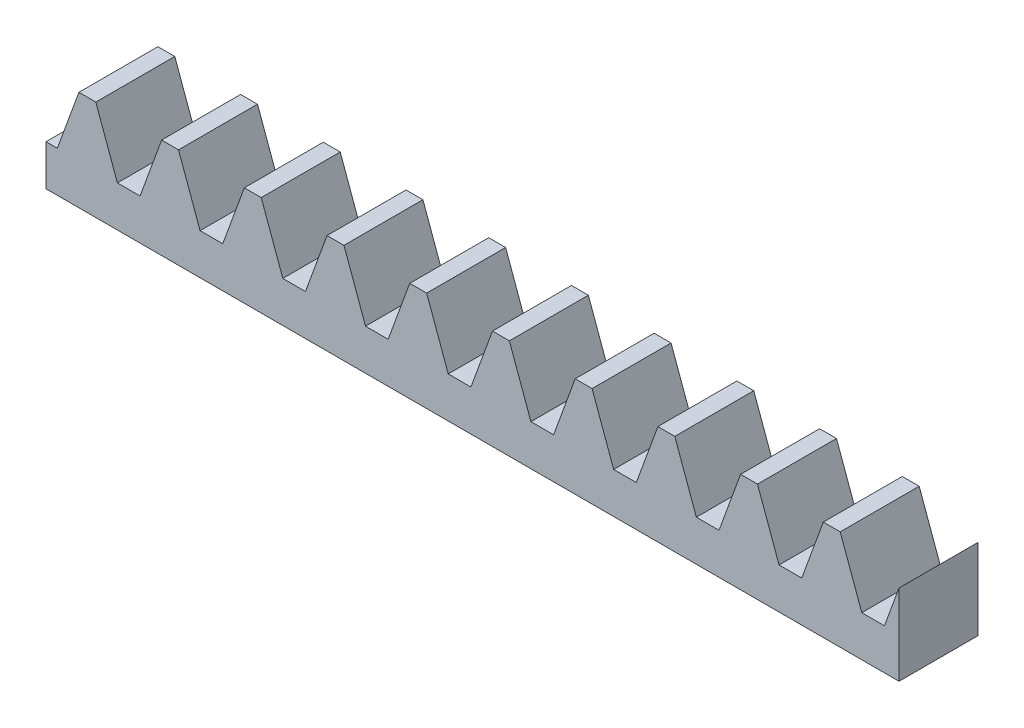
from build123d import *

# Parameters (mm, degrees)
BLANKSKE_W         = 300
BLANKSKE_H         = 45
BLANK_DEPTH        = 30
TOOTHCUTSIM_DEPTH  = 305.836021494
TEETHCUTS_COUNT    = 20
TEETHCUTS_PITCH    = 15.70796325
SKETCH1_W          = 305.531648247
SKETCH1_H          = 78.813182986
CUT_EXTRUDE1_DEPTH = 15
SKETCH2_W          = 303.838018684
SKETCH2_H          = 48.852788509
CUT_EXTRUDE2_DEPTH = 26
SKETCH3_W          = 15
SKETCH3_H          = 19
CUT_EXTRUDE3_DEPTH = 138


with BuildPart() as part:
    # BlankSke → Blank (new body)
    with BuildSketch(Plane.XY):
        with Locations((150, 22.5)):
            Rectangle(BLANKSKE_W, BLANKSKE_H)
    extrude(amount=-BLANK_DEPTH)

    # TooCutSkeSim → ToothCutSim (cut, through all)
    with BuildSketch(Plane.XY):
        Polygon((2.153176848, 33.75), (-2.153176848, 33.75), (-6.257086828, 45.0254), (6.257086828, 45.0254), align=None)
    toothcutsim = extrude(amount=-TOOTHCUTSIM_DEPTH, mode=Mode.SUBTRACT)

    # TeethCuts: ToothCutSim ×20
    with Locations(*[(i * TEETHCUTS_PITCH, 0, 0) for i in range(1, TEETHCUTS_COUNT)]):
        add(toothcutsim, mode=Mode.SUBTRACT)

    # Sketch1 → Cut-Extrude1 (cut)
    with BuildSketch(Plane.XY):
        with Locations((152.765824124, 39.406591493)):
            Rectangle(SKETCH1_W, SKETCH1_H)
    extrude(amount=-CUT_EXTRUDE1_DEPTH, mode=Mode.SUBTRACT)

    # Sketch2 → Cut-Extrude2 (cut)
    with BuildSketch(Plane.XZ):
        with Locations((151.919009342, -5.573605746)):
            Rectangle(SKETCH2_W, SKETCH2_H)
    extrude(amount=-CUT_EXTRUDE2_DEPTH, mode=Mode.SUBTRACT)

    # Sketch3 → Cut-Extrude3 (cut)
    with BuildSketch(Plane(origin=(300, 0, 0), x_dir=(0, 0, -1), z_dir=(1, 0, 0))):
        with Locations((22.5, 35.5)):
            Rectangle(SKETCH3_W, SKETCH3_H)
    extrude(amount=-CUT_EXTRUDE3_DEPTH, mode=Mode.SUBTRACT)


solid = part.part
